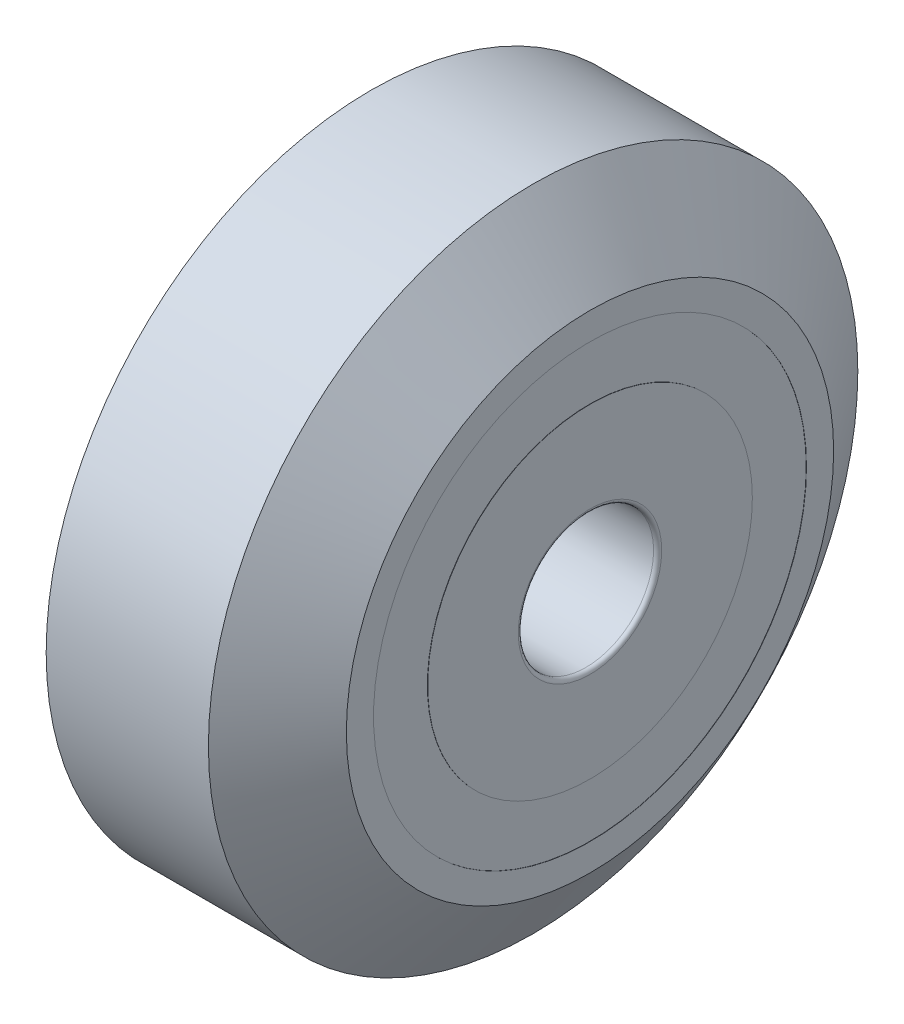
from build123d import *

# Parameters (mm, degrees)
BOSS_EXTRU_2_DEPTH      = 5.1
BOSS_EXTRU_2_DEPTH_BACK = 5.1
ESQUISSE9_R             = 12
ESQUISSE10_R            = 2.5
ENL_V_MAT_EXTRU_3_DEPTH = 20.8
CONG_1_R                = 0.15
ESQUISSE13_R            = 8
ESQUISSE13_R_2          = 6
ENL_V_MAT_EXTRU_4_DEPTH = 0.01
ENL_V_START             = -0.01
ESQUISSE14_R            = 8
ESQUISSE14_R_2          = 6
ENL_V_MAT_EXTRU_5_DEPTH = 0.01


with BuildPart() as part:
    # Esquisse9 → Boss.-Extru.2 (new, two sides: drawn at the far end of the back side and taken through both)
    with BuildSketch(Plane(origin=(5.1, 0, 0), x_dir=(0, 0, -1), z_dir=(1, 0, 0)).offset(-BOSS_EXTRU_2_DEPTH_BACK)):
        Circle(ESQUISSE9_R)
    extrude(amount=BOSS_EXTRU_2_DEPTH + BOSS_EXTRU_2_DEPTH_BACK)

    # Esquisse10 → Enlèv. mat.-Extru.3 (cut, through all)
    with BuildSketch(Plane(origin=(10.2, 0, 0), x_dir=(0, 0, -1), z_dir=(1, 0, 0))):
        Circle(ESQUISSE10_R)
    extrude(amount=-ENL_V_MAT_EXTRU_3_DEPTH, mode=Mode.SUBTRACT)

    # Esquisse11 → Enlèvement de matière-Révolution1 (revolve, cut)
    with BuildSketch(Plane.XY):
        Polygon((0, -9.003888398), (2.102617573, -12), (8.097659703, -12), (10.2, -9.003888398), (10.2, -12), (7.948691549, -12.31078505), (2.020448567, -12.31078505), (0, -12), align=None)
        Polygon((10.2, 12), (7.948691549, 12.31078505), (2.020448567, 12.31078505), (0, 12), (0, 9.003888398), (2.102617573, 12), (8.097659703, 12), (10.2, 9.003888398), align=None)
    revolve(axis=Axis((10.2, 0, 0), (-1, 0, 0)), mode=Mode.SUBTRACT)

    # Congé1
    cong_1_edges = [part.edges().sort_by_distance(p)[0] for p in [
        (10.2, 0, 2.5),
    ]]
    fillet(cong_1_edges, radius=CONG_1_R)

    # Esquisse13 → Enlèv. mat.-Extru.4 (cut)
    with BuildSketch(Plane(origin=(10.2, 0, 0), x_dir=(0, 0, -1), z_dir=(1, 0, 0))):
        Circle(ESQUISSE13_R)
        Circle(ESQUISSE13_R_2, mode=Mode.SUBTRACT)
    extrude(amount=-ENL_V_MAT_EXTRU_4_DEPTH, mode=Mode.SUBTRACT)

    # Esquisse14 → Enlèv. mat.-Extru.5 (cut)
    with BuildSketch(Plane.ZY.offset(ENL_V_START)):
        Circle(ESQUISSE14_R)
        Circle(ESQUISSE14_R_2, mode=Mode.SUBTRACT)
    extrude(amount=ENL_V_MAT_EXTRU_5_DEPTH, mode=Mode.SUBTRACT)


solid = part.part
